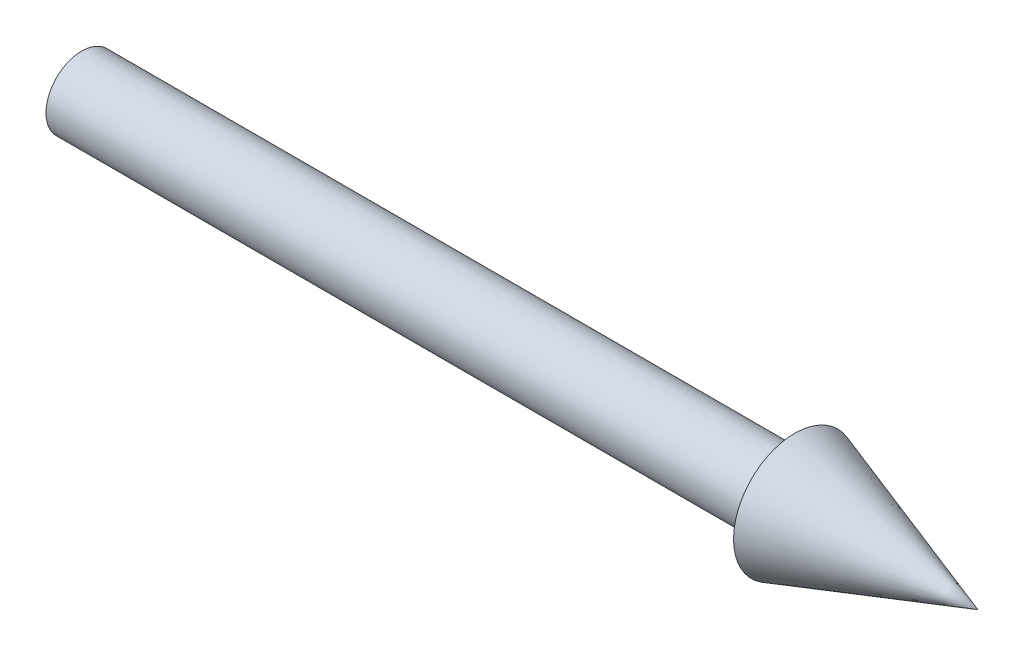
from build123d import *


with BuildPart() as part:
    # 草图1 → 旋转2 (revolve)
    with BuildSketch(Plane(origin=(0, 0, 0), x_dir=(1, 0, 0), z_dir=(0, 1, 0))):
        Polygon((70, -6), (88, 0), (50, 0), (0, 0), (0, -3.5), (70, -3.5), align=None)
    revolve(axis=Axis((0, 0, 0), (1, 0, 0)))


solid = part.part
